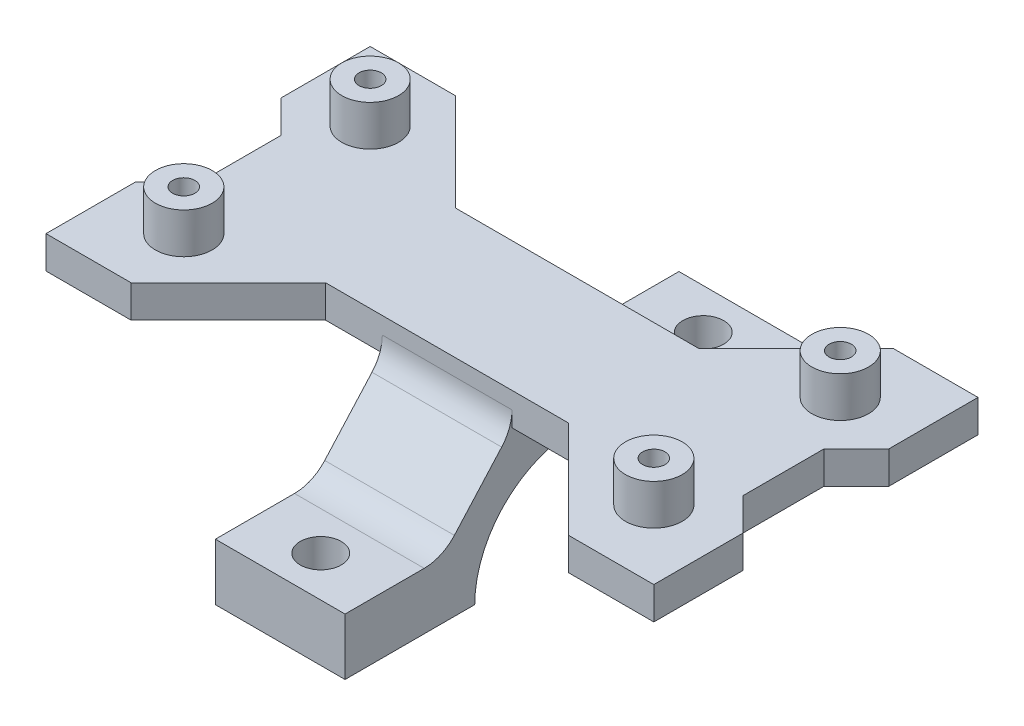
from build123d import *

# Parameters (mm, degrees)
SKETCH1_R                  = 1.375
MOUNT_PLATE_DEPTH          = 4
FEUSELAGE_MOUNT_DEPTH      = 8
SKETCH8_R                  = 3.5
SKETCH8_R_2                = 1.375
MOUNTING_HOLES_DEPTH       = 5
FASTENING_HOLES_DEPTH      = 54.661625022
FASTENING_HOLES_DEPTH_BACK = 8
SKETCH10_R                 = 2.525
FILLET1_R                  = 5


with BuildPart() as part:
    # Sketch1 → Mount_Plate (new body)
    with BuildSketch(Plane(origin=(0, 0, 0), x_dir=(1, 0, 0), z_dir=(0, 1, 0))):
        Polygon((37.5, 20), (37.5, 9), (33.5, 5), (33.5, -5), (37.5, -9), (37.5, -20), (27, -20), (15, -8), (-15, -8), (-27, -20), (-37.5, -20), (-37.5, -9), (-33.5, -5), (-33.5, 5), (-37.5, 9), (-37.5, 20), (-27, 20), (-15, 8), (15, 8), (27, 20), align=None)
        with Locations(Location((-29, -11.5, 0), (0, 0, 270))):
            Circle(SKETCH1_R, mode=Mode.SUBTRACT)
        with Locations(Location((-29, 11.5, 0), (0, 0, 90))):
            Circle(SKETCH1_R, mode=Mode.SUBTRACT)
        with Locations(Location((29, -11.5, 0), (0, 0, 90))):
            Circle(SKETCH1_R, mode=Mode.SUBTRACT)
        with Locations(Location((29, 11.5, 0), (0, 0, 270))):
            Circle(SKETCH1_R, mode=Mode.SUBTRACT)
    extrude(amount=MOUNT_PLATE_DEPTH)

    # Sketch4 → Feuselage_Mount (add, symmetric)
    with BuildSketch(Plane(origin=(0, 0, 0), x_dir=(0, 0, -1), z_dir=(1, 0, 0))):
        with BuildLine():
            Line((-16.6, -9.6), (-28.6, -9.6))
            Line((-28.6, -9.6), (-28.6, -16.6))
            Line((-28.6, -16.6), (-12.6, -16.6))
            ThreePointArc((-12.6, -16.6), (0, -4), (12.6, -16.6))
            Line((12.6, -16.6), (28.6, -16.6))
            Line((28.6, -16.6), (28.6, -9.6))
            Line((28.6, -9.6), (16.6, -9.6))
            Line((16.6, -9.6), (8, 0))
            Line((8, 0), (-8, 0))
            Line((-8, 0), (-16.6, -9.6))
        make_face()
    extrude(amount=FEUSELAGE_MOUNT_DEPTH, both=True)

    # Sketch8 → Mounting_Holes (add)
    # profile 1 of 4: a face of its own
    with BuildSketch(Plane(origin=(0, 4, 0), x_dir=(1, 0, 0), z_dir=(0, 1, 0))):
        with Locations(Location((29, -11.5, 0), (0, 0, 90))):
            Circle(SKETCH8_R)
        with Locations(Location((29, -11.5, 0), (0, 0, 90))):
            Circle(SKETCH8_R_2, mode=Mode.SUBTRACT)
    # profile 2 of 4: a face of its own
    with BuildSketch(Plane(origin=(0, 4, 0), x_dir=(1, 0, 0), z_dir=(0, 1, 0))):
        with Locations(Location((-29, 11.5, 0), (0, 0, 90))):
            Circle(SKETCH8_R)
        with Locations(Location((-29, 11.5, 0), (0, 0, 90))):
            Circle(SKETCH8_R_2, mode=Mode.SUBTRACT)
    # profile 3 of 4: a face of its own
    with BuildSketch(Plane(origin=(0, 4, 0), x_dir=(1, 0, 0), z_dir=(0, 1, 0))):
        with Locations(Location((-29, -11.5, 0), (0, 0, 90))):
            Circle(SKETCH8_R)
        with Locations(Location((-29, -11.5, 0), (0, 0, 270))):
            Circle(SKETCH8_R_2, mode=Mode.SUBTRACT)
    # profile 4 of 4: a face of its own
    with BuildSketch(Plane(origin=(0, 4, 0), x_dir=(1, 0, 0), z_dir=(0, 1, 0))):
        with Locations(Location((29, 11.5, 0), (0, 0, 90))):
            Circle(SKETCH8_R)
        with Locations(Location((29, 11.5, 0), (0, 0, 270))):
            Circle(SKETCH8_R_2, mode=Mode.SUBTRACT)
    extrude(amount=MOUNTING_HOLES_DEPTH)

    # Sketch10 → Fastening_Holes (cut, two sides: drawn at the far end of the back side and taken through both)
    with BuildSketch(Plane.XZ.offset(16.6).offset(-FASTENING_HOLES_DEPTH_BACK)):
        with Locations(Location((0, 23.6, 0), (0, 0, 90))):
            Circle(SKETCH10_R)
        with Locations(Location((0, -23.6, 0), (0, 0, 90))):
            Circle(SKETCH10_R)
    extrude(amount=FASTENING_HOLES_DEPTH + FASTENING_HOLES_DEPTH_BACK, mode=Mode.SUBTRACT)

    # Fillet1
    fillet1_edges = [part.edges().sort_by_distance(p)[0] for p in [
        (0, 0, 8),
        (0, -9.6, 16.6),
        (0, -9.6, -16.6),
        (0, 0, -8),
    ]]
    fillet(fillet1_edges, radius=FILLET1_R)


solid = part.part
